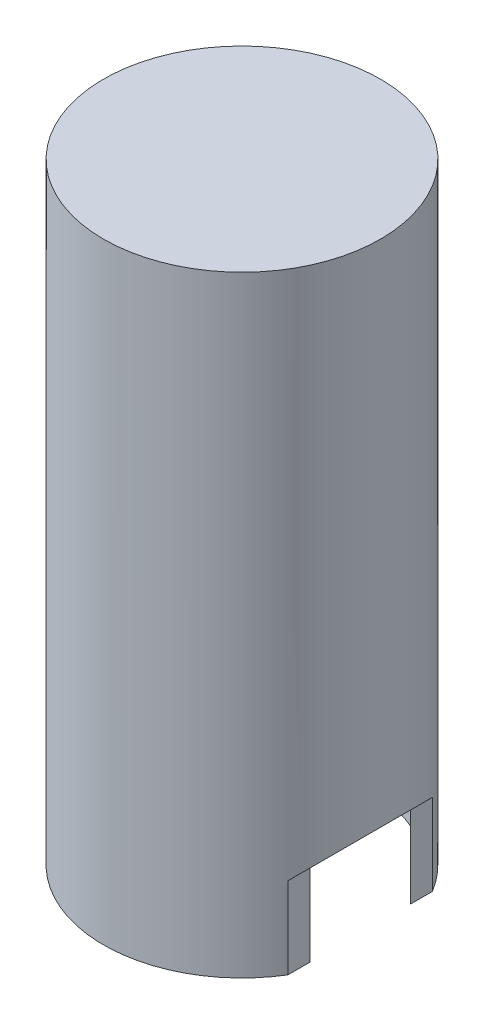
from build123d import *

# Parameters (mm, degrees)
SKETCH3_R               = 68
BOSS_EXTRUDE1_DEPTH     = 300
SHELL1_T                = -5
CUT_EXTRUDE3_DEPTH      = 316.036505821
CUT_EXTRUDE3_DEPTH_BACK = 316.036505821


with BuildPart() as part:
    # Sketch3 → Boss-Extrude1 (new body)
    with BuildSketch(Plane(origin=(0, 0, 0), x_dir=(1, 0, 0), z_dir=(0, 1, 0))):
        Circle(SKETCH3_R)
    extrude(amount=BOSS_EXTRUDE1_DEPTH)

    # Shell1
    shell1_openings = [part.faces().sort_by_distance(p)[0] for p in [
        (0, 0, 0),
    ]]
    offset(amount=SHELL1_T, openings=shell1_openings, kind=Kind.INTERSECTION)

    # Sketch8 → Cut-Extrude3 (cut, two sides: drawn at the far end of the back side and taken through both)
    with BuildSketch(Plane.XY.offset(-CUT_EXTRUDE3_DEPTH_BACK)):
        Polygon((-68, 0), (-58, 0), (-58, 40), (-68, 50), align=None)
        Polygon((68, 0), (58, 0), (58, 40), (68, 50), align=None)
    extrude(amount=CUT_EXTRUDE3_DEPTH + CUT_EXTRUDE3_DEPTH_BACK, mode=Mode.SUBTRACT)


solid = part.part
